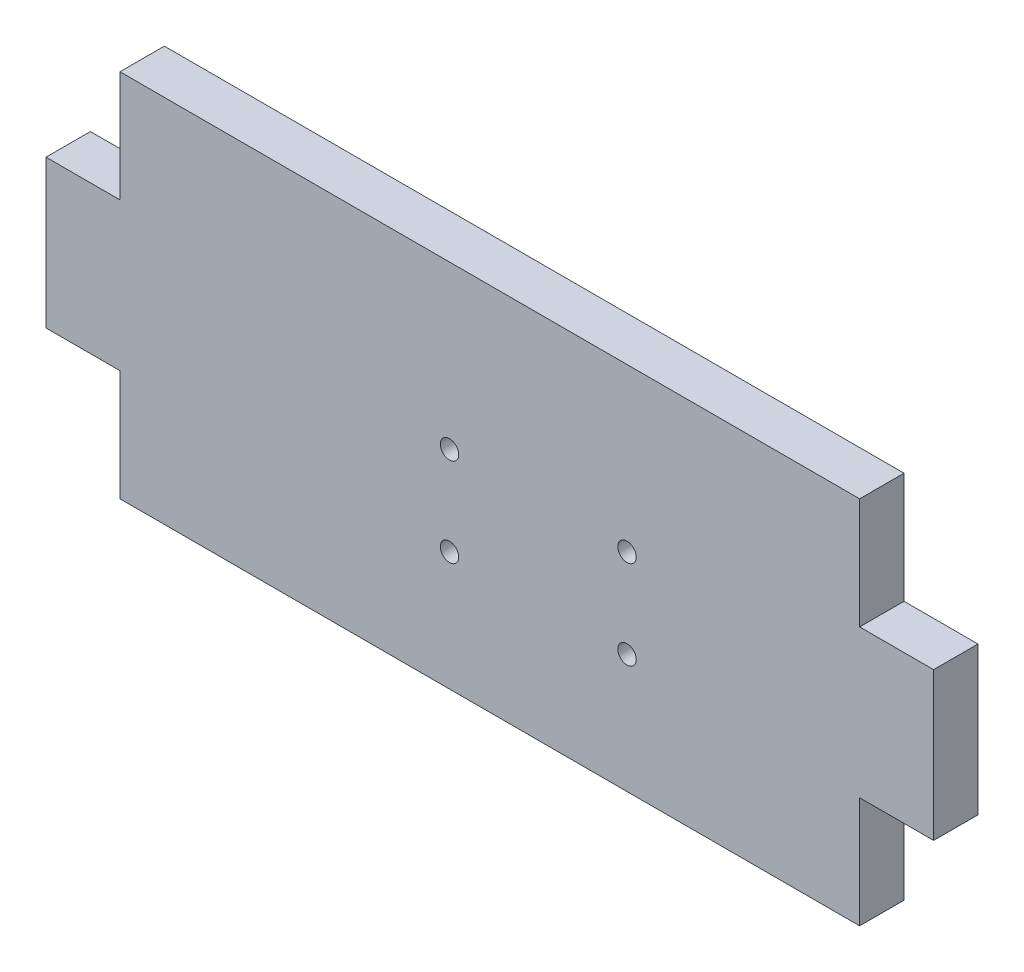
from build123d import *

# Parameters (mm, degrees)
ESQUISSE1_W             = 10
ESQUISSE1_H             = 20
ESQUISSE1_W_2           = 100
ESQUISSE1_H_2           = 50
BOSS_EXTRU_1_DEPTH      = 6
ESQUISSE2_R             = 1.25
ENL_V_MAT_EXTRU_1_DEPTH = 6


with BuildPart() as part:
    # Esquisse1 → Boss.-Extru.1 (new body)
    with BuildSketch(Plane.XY):
        with Locations((-5, 25)):
            Rectangle(ESQUISSE1_W, ESQUISSE1_H)
        with Locations((50, 25)):
            Rectangle(ESQUISSE1_W_2, ESQUISSE1_H_2)
        with Locations((105, 25)):
            Rectangle(ESQUISSE1_W, ESQUISSE1_H)
    extrude(amount=BOSS_EXTRU_1_DEPTH)

    # Esquisse2 → Enlèv. mat.-Extru.1 (cut)
    with BuildSketch(Plane(origin=(0, 0, 0), x_dir=(-1, 0, 0), z_dir=(0, 0, -1))):
        with Locations((-44.550340057, 16.065313345)):
            Circle(ESQUISSE2_R)
        with Locations((-44.550340057, 28.065313345)):
            Circle(ESQUISSE2_R)
        with Locations((-68.550340057, 28.065313345)):
            Circle(ESQUISSE2_R)
        with Locations((-68.550340057, 16.065313345)):
            Circle(ESQUISSE2_R)
    extrude(amount=-ENL_V_MAT_EXTRU_1_DEPTH, mode=Mode.SUBTRACT)


solid = part.part
